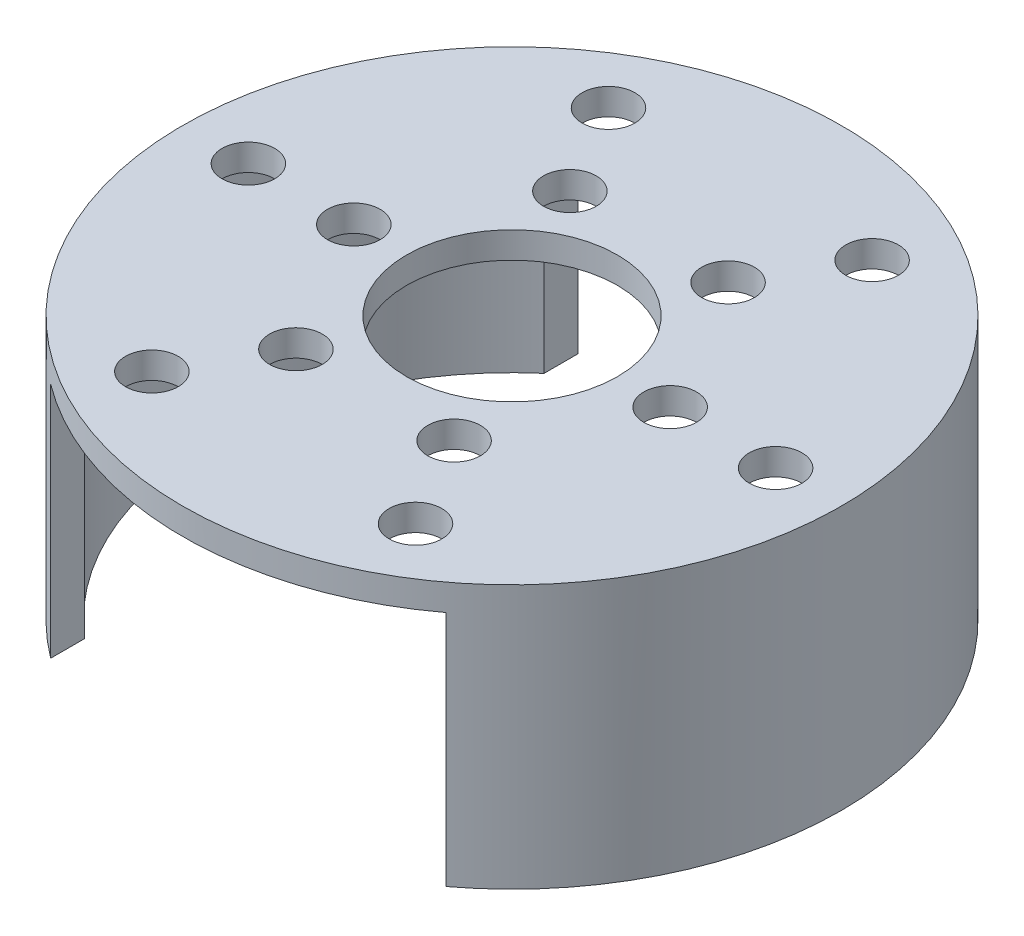
from build123d import *

# Parameters (mm, degrees)
SKETCH1_R               = 12.5
BOSS_EXTRUDE1_DEPTH     = 10
SHELL1_T                = -1
CUT_EXTRUDE1_DEPTH      = 21.310096012
CUT_EXTRUDE1_DEPTH_BACK = 21.310096012
SKETCH2_W               = 15
SKETCH2_H               = 9
SKETCH3_R               = 1
CUT_EXTRUDE2_DEPTH      = 10
SKETCH4_R               = 4
CUT_EXTRUDE3_DEPTH      = 10


with BuildPart() as part:
    # Sketch1 → Boss-Extrude1 (new body)
    with BuildSketch(Plane(origin=(0, 0, 0), x_dir=(1, 0, 0), z_dir=(0, 1, 0))):
        with Locations(Location((0, 0, 0), (0, 0, 270))):
            Circle(SKETCH1_R)
    extrude(amount=BOSS_EXTRUDE1_DEPTH)

    # Shell1
    shell1_openings = [part.faces().sort_by_distance(p)[0] for p in [
        (0, 0, 0),
    ]]
    offset(amount=SHELL1_T, openings=shell1_openings, kind=Kind.INTERSECTION)

    # Sketch2 → Cut-Extrude1 (cut, two sides: drawn at the far end of the back side and taken through both)
    with BuildSketch(Plane.XY.offset(-CUT_EXTRUDE1_DEPTH_BACK)):
        with Locations((0, 4.5)):
            Rectangle(SKETCH2_W, SKETCH2_H)
    extrude(amount=CUT_EXTRUDE1_DEPTH + CUT_EXTRUDE1_DEPTH_BACK, mode=Mode.SUBTRACT)

    # Sketch3 → Cut-Extrude2 (cut)
    with BuildSketch(Plane(origin=(0, 10, 0), x_dir=(1, 0, 0), z_dir=(0, 1, 0))):
        with Locations(Location((-10, 0, 0), (0, 0, 270))):
            Circle(SKETCH3_R)
        with Locations(Location((-6, 0, 0), (0, 0, 270))):
            Circle(SKETCH3_R)
        with Locations(Location((-5, 8.660254038, 0), (0, 0, 270))):
            Circle(SKETCH3_R)
        with Locations(Location((-3, 5.196152423, 0), (0, 0, 270))):
            Circle(SKETCH3_R)
        with Locations(Location((5, 8.660254038, 0), (0, 0, 270))):
            Circle(SKETCH3_R)
        with Locations(Location((3, 5.196152423, 0), (0, 0, 270))):
            Circle(SKETCH3_R)
        with Locations(Location((10, 0, 0), (0, 0, 270))):
            Circle(SKETCH3_R)
        with Locations(Location((6, 0, 0), (0, 0, 270))):
            Circle(SKETCH3_R)
        with Locations(Location((5, -8.660254038, 0), (0, 0, 270))):
            Circle(SKETCH3_R)
        with Locations(Location((3, -5.196152423, 0), (0, 0, 270))):
            Circle(SKETCH3_R)
        with Locations(Location((-5, -8.660254038, 0), (0, 0, 270))):
            Circle(SKETCH3_R)
        with Locations(Location((-3, -5.196152423, 0), (0, 0, 270))):
            Circle(SKETCH3_R)
    extrude(amount=-CUT_EXTRUDE2_DEPTH, mode=Mode.SUBTRACT)

    # Sketch4 → Cut-Extrude3 (cut)
    with BuildSketch(Plane(origin=(0, 10, 0), x_dir=(1, 0, 0), z_dir=(0, 1, 0))):
        with Locations(Location((0, 0, 0), (0, 0, 270))):
            Circle(SKETCH4_R)
    extrude(amount=-CUT_EXTRUDE3_DEPTH, mode=Mode.SUBTRACT)


solid = part.part
